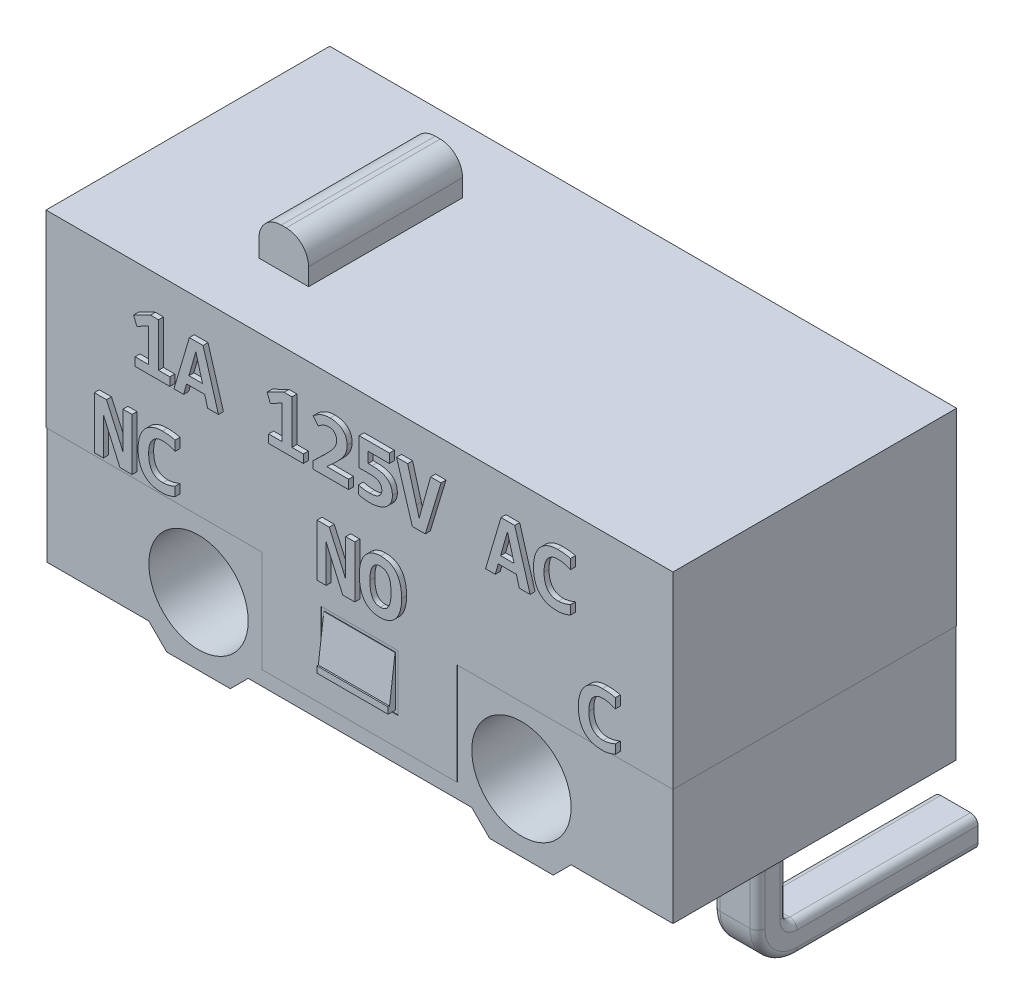
from build123d import *

# Parameters (mm, degrees)
IZIM1_R                     = 1
Y_KSEKLIK_EKSTR_ZYON1_DEPTH = 5.7
IZIM2_W                     = 1.555423368
IZIM2_H                     = 1.128679348
Y_KSEKLIK_EKSTR_ZYON2_DEPTH = 0.01
IZIM3_W                     = 5.71
IZIM3_H                     = 3.791444843
Y_KSEKLIK_EKSTR_ZYON3_DEPTH = 0.01
IZIM4_W                     = 1.433547672
IZIM4_H                     = 1.00666385
Y_KSEKLIK_EKSTR_ZYON4_DEPTH = 0.15
KES_EKSTR_ZYON1_DEPTH       = 2.15
IZIM7_W                     = 1
IZIM7_H                     = 3.1
Y_KSEKLIK_EKSTR_ZYON5_DEPTH = 0.8
RADYUS1_R                   = 0.45
IZIM8_W                     = 0.9
IZIM8_H                     = 0.6
IZIM12_W                    = 0.9
IZIM12_H                    = 0.6
RADYUS2_R                   = 0.15
Y_KSEKLIK_EKSTR_ZYON6_DEPTH = 0.1


with BuildPart() as part:
    # Çizim1 → Yükseklik-Ekstrüzyon1 (new body)
    with BuildSketch(Plane.XY):
        Polygon((-2.25, -2.89003396), (2.25, -2.89003396), (2.60996604, -3.25), (3.89003396, -3.25), (4.25, -2.89003396), (6.3, -2.89003396), (6.3, 3.25), (-6.3, 3.25), (-6.3, -2.89003396), (-4.25, -2.89003396), (-3.89003396, -3.25), (-2.60996604, -3.25), align=None)
        with Locations((-3.25, -1.89003396)):
            Circle(IZIM1_R, mode=Mode.SUBTRACT)
        with Locations((3.25, -1.89003396)):
            Circle(IZIM1_R, mode=Mode.SUBTRACT)
    extrude(amount=Y_KSEKLIK_EKSTR_ZYON1_DEPTH)

    # Çizim2 → Yükseklik-Ekstrüzyon2 (add)
    with BuildSketch(Plane.XY.offset(5.7)):
        Polygon((-6.3, -0.541444843), (-1.959045888, -0.541444843), (-1.959045888, -2.589090797), (1.959045888, -2.589090797), (1.959045888, -0.541444843), (6.3, -0.541444843), (6.3, 3.25), (-6.3, 3.25), align=None)
        with Locations((0, -1.453772924)):
            Rectangle(IZIM2_W, IZIM2_H, mode=Mode.SUBTRACT)
    extrude(amount=Y_KSEKLIK_EKSTR_ZYON2_DEPTH)

    # Çizim3 → Yükseklik-Ekstrüzyon3 (add)
    with BuildSketch(Plane(origin=(6.3, 0, 0), x_dir=(0, 0, -1), z_dir=(1, 0, 0))):
        with Locations((-2.855, 1.354277579)):
            Rectangle(IZIM3_W, IZIM3_H)
    y_kseklik_ekstr_zyon3 = extrude(amount=Y_KSEKLIK_EKSTR_ZYON3_DEPTH)

    # Aynalama1: Yükseklik-Ekstrüzyon3 across plane
    add(y_kseklik_ekstr_zyon3.mirror(Plane(origin=(0, 0, 0), x_dir=(0, 0, 1), z_dir=(1, 0, 0))))

    # Çizim4 → Yükseklik-Ekstrüzyon4 (add)
    with BuildSketch(Plane.XY.offset(5.7)):
        with Locations((0, -1.453772924)):
            Rectangle(IZIM4_W, IZIM4_H)
    extrude(amount=Y_KSEKLIK_EKSTR_ZYON4_DEPTH)

    # Çizim5 → Kes-Ekstrüzyon1 (cut)
    with BuildSketch(Plane(origin=(0.716773836, 0, 0), x_dir=(0, 0, -1), z_dir=(1, 0, 0))):
        Polygon((-5.85, -1.828901047), (-5.821636006, -1.828901047), (-5.71, -0.950440999), (-5.85, -0.950440999), align=None)
    extrude(amount=-KES_EKSTR_ZYON1_DEPTH, mode=Mode.SUBTRACT)

    # Çizim7 → Yükseklik-Ekstrüzyon5 (add)
    with BuildSketch(Plane(origin=(0, 3.25, 0), x_dir=(1, 0, 0), z_dir=(0, 1, 0))):
        with Locations((-2.829853544, -2.855)):
            Rectangle(IZIM7_W, IZIM7_H)
    extrude(amount=Y_KSEKLIK_EKSTR_ZYON5_DEPTH)

    # Radyus1
    radyus1_edges = [part.edges().sort_by_distance(p)[0] for p in [
        (-2.329853544, 4.05, 2.855),
        (-3.329853544, 4.05, 2.855),
    ]]
    fillet(radyus1_edges, radius=RADYUS1_R)

    # Süpür1: sweep along a path in Çizim10
    with BuildLine(Plane(origin=(-5, 0, 0), x_dir=(0, 0, -1), z_dir=(1, 0, 0))) as s_p_r1_path:
        Line((-2.85, -2.89003396), (-2.85, -4.75))
        ThreePointArc((-2.85, -4.75), (-2.703553391, -5.103553391), (-2.35, -5.25))
        Line((-2.35, -5.25), (1.29, -5.25))
    # Çizim8 → Süpür1 (sweep)
    with BuildSketch(Plane(origin=(0, -2.89003396, 0), x_dir=(-1, 0, 0), z_dir=(0, -1, 0))):
        with Locations((5, -2.85)):
            Rectangle(IZIM8_W, IZIM8_H)
    s_p_r1 = sweep(path=s_p_r1_path.line)

    # Süpür2: sweep along a path in Çizim13
    with BuildLine(Plane(origin=(0, 0, 0), x_dir=(0, 0, -1), z_dir=(1, 0, 0))) as s_p_r2_path:
        Line((-2.85, -2.89003396), (-2.85, -4.75))
        ThreePointArc((-2.85, -4.75), (-2.703553391, -5.103553391), (-2.35, -5.25))
        Line((-2.35, -5.25), (1.29, -5.25))
    # Çizim12 → Süpür2 (sweep)
    with BuildSketch(Plane.XZ.offset(2.89003396)):
        with Locations((0, 2.85)):
            Rectangle(IZIM12_W, IZIM12_H)
    sweep(path=s_p_r2_path.line)

    # Aynalama2: Süpür1 across plane
    add(s_p_r1.mirror(Plane(origin=(0, 0, 0), x_dir=(0, 0, 1), z_dir=(1, 0, 0))))

    # Radyus2
    radyus2_edges = [part.edges().sort_by_distance(p)[0] for p in [
        (-5.45, -5.55, 0.53),
        (-4.55, -4.95, 0.53),
        (-5.45, -5.315685425, 2.915685425),
        (-4.55, -4.891421356, 2.491421356),
        (-4.55, -5.315685425, 2.915685425),
        (-4.55, -5.55, 0.53),
        (-4.55, -3.82001698, 2.55),
        (-4.55, -3.82001698, 3.15),
        (-5.45, -4.891421356, 2.491421356),
        (-5.45, -4.95, 0.53),
        (-5.45, -3.82001698, 3.15),
        (-5.45, -3.82001698, 2.55),
        (-0.45, -5.55, 0.53),
        (0.45, -4.95, 0.53),
        (-0.45, -5.315685425, 2.915685425),
        (0.45, -4.891421356, 2.491421356),
        (0.45, -5.315685425, 2.915685425),
        (0.45, -5.55, 0.53),
        (0.45, -3.82001698, 2.55),
        (0.45, -3.82001698, 3.15),
        (-0.45, -4.891421356, 2.491421356),
        (-0.45, -4.95, 0.53),
        (-0.45, -3.82001698, 3.15),
        (-0.45, -3.82001698, 2.55),
        (5.45, -4.95, 0.53),
        (4.55, -5.55, 0.53),
        (5.45, -4.891421356, 2.491421356),
        (4.55, -5.315685425, 2.915685425),
        (4.55, -4.891421356, 2.491421356),
        (4.55, -4.95, 0.53),
        (4.55, -3.82001698, 3.15),
        (4.55, -3.82001698, 2.55),
        (5.45, -5.315685425, 2.915685425),
        (5.45, -5.55, 0.53),
        (5.45, -3.82001698, 2.55),
        (5.45, -3.82001698, 3.15),
    ]]
    fillet(radyus2_edges, radius=RADYUS2_R)

    # Çizim14 → Yükseklik-Ekstrüzyon6 (add)
    # profile 1 of 13: a face of its own
    with BuildSketch(Plane.XY.offset(5.71)):
        Polygon((-4.416969828, 1.520931058), (-4.416969828, 1.68800321), (-4.143579033, 1.68800321), (-4.143579033, 2.362699416), (-4.381609386, 2.2347848), (-4.447346583, 2.401856952), (-4.107506636, 2.568929105), (-3.946130126, 2.568929105), (-3.946130126, 1.68800321), (-3.718304463, 1.68800321), (-3.718304463, 1.520931058), align=None)
    # profile 2 of 13: a face of its own
    with BuildSketch(Plane.XY.offset(5.71)):
        Polygon((-2.956512405, 1.520931058), (-3.014892731, 1.733568343), (-3.379651109, 1.733568343), (-3.439455345, 1.520931058), (-3.634768387, 1.520931058), (-3.323881285, 2.568929105), (-3.048354625, 2.568929105), (-2.738654115, 1.520931058), align=None)
        Polygon((-3.19430544, 2.389279077), (-3.332187429, 1.900640495), (-3.060457863, 1.900640495), align=None, mode=Mode.SUBTRACT)
    # profile 3 of 13: a face of its own
    with BuildSketch(Plane.XY.offset(5.71)):
        Polygon((-1.728627012, 1.520931058), (-1.728627012, 1.68800321), (-1.455236217, 1.68800321), (-1.455236217, 2.362699416), (-1.693266571, 2.2347848), (-1.759003767, 2.401856952), (-1.419163821, 2.568929105), (-1.25778731, 2.568929105), (-1.25778731, 1.68800321), (-1.029961647, 1.68800321), (-1.029961647, 1.520931058), align=None)
    # profile 4 of 13: a face of its own
    with BuildSketch(Plane.XY.offset(5.71)):
        with BuildLine():
            Line((-0.83251274, 1.520931058), (-0.83251274, 1.667356509))
            Line((-0.83251274, 1.667356509), (-0.580005964, 1.912031778))
            add(Edge.make_bspline(
                [(-0.580005964, 1.912031778), (-0.568618879, 1.923111493), (-0.546845415, 1.944297229), (-0.516860272, 1.975782675), (-0.489912698, 2.004389433), (-0.466378649, 2.030894134), (-0.446103378, 2.055791112), (-0.428262301, 2.079033858), (-0.412737093, 2.100778787), (-0.399792831, 2.121408063), (-0.388938534, 2.140910578), (-0.380440981, 2.159694798), (-0.373631265, 2.177573782), (-0.367280961, 2.200602736), (-0.362873944, 2.229710002), (-0.362075499, 2.253122839), (-0.361673038, 2.264924236)],
                knots=[0, 0, 0, 0, 1.561346149, 2.985479849, 4.272660798, 5.42387168, 6.4681479, 7.427594435, 8.303382019, 9.092890023, 9.820107477, 10.495077279, 11.117492523, 11.698467986, 12.839897307, 14, 14, 14, 14], degree=3))
            add(Edge.make_bspline(
                [(-0.361673038, 2.264924236), (-0.362093806, 2.275020659), (-0.362927136, 2.295016548), (-0.370603558, 2.3237196), (-0.382161257, 2.350186268), (-0.399238486, 2.372833561), (-0.420550739, 2.391924473), (-0.442151649, 2.403658199), (-0.461428388, 2.410480927), (-0.477180173, 2.414231505), (-0.4939374, 2.416739507), (-0.505478318, 2.416941381), (-0.511420947, 2.41704533)],
                knots=[0, 0, 0, 0, 1.259052347, 2.493543675, 3.687736162, 4.846054809, 6.008246034, 7.237941048, 7.888132915, 8.5593184, 9.258166694, 10, 10, 10, 10], degree=3))
            add(Edge.make_bspline(
                [(-0.511420947, 2.41704533), (-0.521640591, 2.416692468), (-0.541783819, 2.415996967), (-0.571437087, 2.41148749), (-0.599917448, 2.403567533), (-0.627191172, 2.39246543), (-0.653709491, 2.379134271), (-0.679239373, 2.363317978), (-0.70436182, 2.345832994), (-0.720120807, 2.332606046), (-0.728092645, 2.325915065)],
                knots=[0, 0, 0, 0, 1.020414048, 2.011267059, 2.986668027, 3.96497488, 4.94697347, 5.946696085, 6.961316025, 8, 8, 8, 8], degree=3))
            Line((-0.728092645, 2.325915065), (-0.83251274, 2.451931134))
            add(Edge.make_bspline(
                [(-0.83251274, 2.451931134), (-0.820875157, 2.461616652), (-0.7975957, 2.48099126), (-0.759881216, 2.506655407), (-0.719969933, 2.529145857), (-0.678086879, 2.548715926), (-0.634243611, 2.56490538), (-0.588169444, 2.575769765), (-0.540449883, 2.583084397), (-0.507968484, 2.583769722), (-0.491486202, 2.584117482)],
                knots=[0, 0, 0, 0, 0.971414743, 1.943187718, 2.923163908, 3.90905488, 4.908116413, 5.916732171, 6.942871654, 8, 8, 8, 8], degree=3))
            add(Edge.make_bspline(
                [(-0.491486202, 2.584117482), (-0.478897759, 2.58392083), (-0.454214574, 2.583535238), (-0.418130972, 2.579598786), (-0.38384468, 2.573516084), (-0.351446149, 2.564975401), (-0.320995101, 2.554102373), (-0.292644628, 2.540845568), (-0.266607186, 2.52512357), (-0.24294189, 2.506998646), (-0.221703638, 2.486441412), (-0.202745595, 2.463543911), (-0.186673814, 2.438016831), (-0.173083081, 2.410258174), (-0.162014803, 2.380346156), (-0.154680405, 2.348025438), (-0.149642315, 2.313653789), (-0.149241833, 2.289941399), (-0.149035753, 2.27773943)],
                knots=[0, 0, 0, 0, 1.159472778, 2.273472863, 3.340013536, 4.365414322, 5.356781803, 6.31537468, 7.244130825, 8.153815157, 9.055875647, 9.962049253, 10.886103095, 11.828148954, 12.805810483, 13.817047342, 14.876691883, 16, 16, 16, 16], degree=3))
            add(Edge.make_bspline(
                [(-0.149035753, 2.27773943), (-0.1491657, 2.267523156), (-0.149422291, 2.247350282), (-0.153036544, 2.217643138), (-0.157984397, 2.188839393), (-0.16582431, 2.161154248), (-0.175347668, 2.134206912), (-0.186772606, 2.107683963), (-0.200432529, 2.08166644), (-0.215618895, 2.055705984), (-0.232714422, 2.029954467), (-0.252192091, 2.004671181), (-0.272963035, 1.978863311), (-0.296101953, 1.953355838), (-0.321019617, 1.927548317), (-0.346953047, 1.900474722), (-0.375304842, 1.873444737), (-0.39473035, 1.855144126), (-0.404627668, 1.845819945)],
                knots=[0, 0, 0, 0, 0.945736526, 1.867434716, 2.768631143, 3.650402628, 4.528787893, 5.414963327, 6.32280855, 7.249039709, 8.200182995, 9.183579422, 10.204429958, 11.268168642, 12.372135405, 13.527717836, 14.740369513, 16, 16, 16, 16], degree=3))
            Line((-0.404627668, 1.845819945), (-0.559121945, 1.703191588))
            Line((-0.559121945, 1.703191588), (-0.118658998, 1.703191588))
            Line((-0.118658998, 1.703191588), (-0.118658998, 1.520931058))
            Line((-0.118658998, 1.520931058), (-0.83251274, 1.520931058))
        make_face()
    # profile 5 of 13: a face of its own
    with BuildSketch(Plane.XY.offset(5.71)):
        with BuildLine():
            add(Edge.make_bspline(
                [(0.762266897, 1.857923183), (0.761895026, 1.844209736), (0.761168127, 1.817403983), (0.754356799, 1.778402068), (0.743185557, 1.74180657), (0.727628668, 1.7076253), (0.708128304, 1.676062855), (0.68498206, 1.647037651), (0.65869401, 1.620378144), (0.62874809, 1.59665582), (0.59595164, 1.575442276), (0.560089633, 1.557335661), (0.521736843, 1.541181585), (0.480515774, 1.52840752), (0.437079713, 1.518095939), (0.391583807, 1.511236892), (0.344372287, 1.506442165), (0.31224467, 1.505978197), (0.295936244, 1.50574268)],
                knots=[0, 0, 0, 0, 1.003806332, 1.962145891, 2.889593837, 3.79979359, 4.705166527, 5.600170263, 6.513886126, 7.441460774, 8.392979074, 9.369986185, 10.380460185, 11.437875437, 12.52715139, 13.647472168, 14.805824136, 16, 16, 16, 16], degree=3))
            add(Edge.make_bspline(
                [(0.295936244, 1.50574268), (0.287391207, 1.505928885), (0.269655019, 1.506315374), (0.242490559, 1.507920949), (0.214343903, 1.510907864), (0.185850997, 1.514398448), (0.157415561, 1.518603001), (0.129787725, 1.523744045), (0.103616714, 1.529651786), (0.086848125, 1.534020184), (0.07878991, 1.536119435)],
                knots=[0, 0, 0, 0, 0.933203419, 1.936969169, 2.970037408, 4.023167792, 5.071256358, 6.108037116, 7.090809354, 8, 8, 8, 8], degree=3))
            Line((0.07878991, 1.536119435), (0.07878991, 1.703191588))
            add(Edge.make_bspline(
                [(0.07878991, 1.703191588), (0.086676926, 1.700885185), (0.102818325, 1.696164951), (0.12823615, 1.690642574), (0.15519634, 1.685360592), (0.19365415, 1.679379484), (0.243507414, 1.67406946), (0.283896658, 1.673235123), (0.304242388, 1.672814833)],
                knots=[0, 0, 0, 0, 0.647950827, 1.326082186, 2.050513233, 2.814747821, 4.395456963, 6, 6, 6, 6], degree=3))
            add(Edge.make_bspline(
                [(0.304242388, 1.672814833), (0.313897751, 1.672942485), (0.33267955, 1.673190797), (0.36001503, 1.675369849), (0.385637938, 1.678817776), (0.409392014, 1.683868398), (0.431477997, 1.68988102), (0.451572469, 1.697801637), (0.470145745, 1.706758321), (0.486716002, 1.717465722), (0.501452685, 1.729373601), (0.514496885, 1.742159344), (0.52521, 1.756437821), (0.534301196, 1.771552185), (0.541321742, 1.787908071), (0.545853524, 1.805372603), (0.54921472, 1.823780065), (0.549489027, 1.836468948), (0.549629612, 1.842972124)],
                knots=[0, 0, 0, 0, 1.376103243, 2.676822839, 3.906334316, 5.058542542, 6.13657794, 7.164747953, 8.132985769, 9.071346473, 9.969481245, 10.830611169, 11.667327079, 12.506622408, 13.340217227, 14.193708991, 15.074258204, 16, 16, 16, 16], degree=3))
            add(Edge.make_bspline(
                [(0.549629612, 1.842972124), (0.549430958, 1.849702361), (0.549046097, 1.862741124), (0.546539601, 1.881740139), (0.54168733, 1.899280112), (0.535381417, 1.915642131), (0.526866811, 1.930432316), (0.516944871, 1.944226538), (0.504676504, 1.956257961), (0.490683085, 1.967122658), (0.474688518, 1.976661741), (0.456350532, 1.984635695), (0.436008621, 1.991788587), (0.413209366, 1.997475412), (0.388189309, 2.001553566), (0.360944875, 2.004646464), (0.331481158, 2.006534522), (0.311048361, 2.006814072), (0.300445294, 2.006959137)],
                knots=[0, 0, 0, 0, 0.950031935, 1.840535706, 2.696350568, 3.513191612, 4.308068879, 5.09854323, 5.903780938, 6.723364091, 7.594552156, 8.524092423, 9.540980844, 10.63493007, 11.835307573, 13.116308258, 14.503583317, 16, 16, 16, 16], degree=3))
            Line((0.300445294, 2.006959137), (0.093978287, 2.006959137))
            Line((0.093978287, 2.006959137), (0.093978287, 2.568929105))
            Line((0.093978287, 2.568929105), (0.701513387, 2.568929105))
            Line((0.701513387, 2.568929105), (0.701513387, 2.386668575))
            Line((0.701513387, 2.386668575), (0.276238817, 2.386668575))
            Line((0.276238817, 2.386668575), (0.276238817, 2.17403129))
            Line((0.276238817, 2.17403129), (0.352655341, 2.17403129))
            add(Edge.make_bspline(
                [(0.352655341, 2.17403129), (0.366027875, 2.173828331), (0.392560681, 2.173425635), (0.431854796, 2.170840532), (0.470264713, 2.166288282), (0.507547814, 2.160030337), (0.543462107, 2.151582305), (0.577433995, 2.140644183), (0.609019056, 2.126356897), (0.638539483, 2.109909614), (0.66567584, 2.0903872), (0.689763138, 2.067390883), (0.710987265, 2.041290628), (0.729532214, 2.01215692), (0.744379722, 1.979219422), (0.755043647, 1.942341034), (0.761090753, 1.901393549), (0.761863966, 1.872815518), (0.762266897, 1.857923183)],
                knots=[0, 0, 0, 0, 1.087776032, 2.158285899, 3.201468592, 4.232895783, 5.231774263, 6.200368663, 7.130739854, 8.04700741, 8.945408995, 9.842057509, 10.747551757, 11.675873473, 12.643505556, 13.67589576, 14.788883008, 16, 16, 16, 16], degree=3))
        make_face()
    # profile 6 of 13: a face of its own
    with BuildSketch(Plane.XY.offset(5.71)):
        Polygon((1.424859865, 1.520931058), (1.163809627, 1.520931058), (0.845802973, 2.568929105), (1.069356904, 2.568929105), (1.244972519, 1.937899483), (1.301454298, 1.73095784), (1.359597305, 1.949765403), (1.532127781, 2.568929105), (1.741917245, 2.568929105), align=None)
    # profile 7 of 13: a face of its own
    with BuildSketch(Plane.XY.offset(5.71)):
        Polygon((3.316287499, 1.520931058), (3.257907173, 1.733568343), (2.893148795, 1.733568343), (2.833344559, 1.520931058), (2.638031517, 1.520931058), (2.948918619, 2.568929105), (3.224445279, 2.568929105), (3.534145789, 1.520931058), align=None)
        Polygon((3.078494464, 2.389279077), (2.940612475, 1.900640495), (3.212342041, 1.900640495), align=None, mode=Mode.SUBTRACT)
    # profile 8 of 13: a face of its own
    with BuildSketch(Plane.XY.offset(5.71)):
        with BuildLine():
            add(Edge.make_bspline(
                [(4.346723984, 1.56649619), (4.335142586, 1.561552242), (4.312420239, 1.551852366), (4.278075455, 1.539554), (4.244357513, 1.529045417), (4.210944487, 1.520448665), (4.177469104, 1.513601636), (4.143505009, 1.509319837), (4.108907983, 1.506244695), (4.08560172, 1.505911361), (4.073807826, 1.50574268)],
                knots=[0, 0, 0, 0, 1.072602722, 2.104413604, 3.106297595, 4.08050826, 5.042709706, 6.014913564, 6.995467464, 8, 8, 8, 8], degree=3))
            add(Edge.make_bspline(
                [(4.073807826, 1.50574268), (4.055358331, 1.506146483), (4.019537694, 1.506930486), (3.967344393, 1.513185612), (3.918469916, 1.523519437), (3.872741153, 1.537945776), (3.830496971, 1.556795435), (3.791536637, 1.579679831), (3.755933604, 1.606604083), (3.723934724, 1.637714266), (3.695483845, 1.672793926), (3.671045375, 1.712159077), (3.649856164, 1.755198445), (3.632543447, 1.802298157), (3.619071829, 1.853319697), (3.60952636, 1.908262108), (3.603423934, 1.967110372), (3.602809971, 2.007655219), (3.602493487, 2.028555112)],
                knots=[0, 0, 0, 0, 1.102605573, 2.140764961, 3.136846793, 4.08496906, 5.001529512, 5.896051515, 6.780328523, 7.66316301, 8.557497515, 9.473264751, 10.427030373, 11.420482266, 12.467702166, 13.577100782, 14.751053738, 16, 16, 16, 16], degree=3))
            add(Edge.make_bspline(
                [(3.602493487, 2.028555112), (3.602873191, 2.050011314), (3.603613371, 2.091837296), (3.610231424, 2.152663861), (3.620369363, 2.209990175), (3.635477149, 2.263435534), (3.654060743, 2.31326291), (3.676750613, 2.358948459), (3.702592575, 2.400911376), (3.732459639, 2.438580331), (3.765765201, 2.472236598), (3.802641969, 2.501570897), (3.842640138, 2.526943108), (3.886211929, 2.547599688), (3.932760871, 2.563903187), (3.982173671, 2.575883178), (4.034456254, 2.582748691), (4.070228034, 2.583654338), (4.088521567, 2.584117482)],
                knots=[0, 0, 0, 0, 1.232307787, 2.402218284, 3.511138658, 4.573037126, 5.588482404, 6.562047137, 7.499038646, 8.414657469, 9.317692522, 10.213424542, 11.116219401, 12.033010505, 12.977368732, 13.94518829, 14.949178196, 16, 16, 16, 16], degree=3))
            add(Edge.make_bspline(
                [(4.088521567, 2.584117482), (4.10023139, 2.584128101), (4.122945812, 2.584148699), (4.156162629, 2.582696162), (4.188022243, 2.581404664), (4.21916738, 2.577990832), (4.25025796, 2.574236609), (4.281661952, 2.568367491), (4.314026171, 2.562351798), (4.335680474, 2.55664907), (4.346723984, 2.553740727)],
                knots=[0, 0, 0, 0, 1.077376558, 2.089868288, 3.059369192, 4.010411707, 4.972009834, 5.940198088, 6.949518525, 8, 8, 8, 8], degree=3))
            Line((4.346723984, 2.553740727), (4.346723984, 2.35629182))
            add(Edge.make_bspline(
                [(4.346723984, 2.35629182), (4.335389472, 2.361489443), (4.313194809, 2.371667164), (4.279599477, 2.384351971), (4.246989037, 2.395256413), (4.215095839, 2.403133966), (4.184542969, 2.409409998), (4.155216728, 2.413644637), (4.127335731, 2.41639783), (4.109174062, 2.41683421), (4.100387487, 2.41704533)],
                knots=[0, 0, 0, 0, 1.170030163, 2.291093263, 3.368831198, 4.395296508, 5.372370687, 6.295361994, 7.175300008, 8, 8, 8, 8], degree=3))
            add(Edge.make_bspline(
                [(4.100387487, 2.41704533), (4.088187591, 2.416747353), (4.06462782, 2.416171918), (4.030602563, 2.41116653), (3.999332272, 2.402698867), (3.970854826, 2.390704291), (3.944934323, 2.37579577), (3.921274797, 2.358265014), (3.900299409, 2.337603196), (3.881730884, 2.314462051), (3.865496058, 2.288793705), (3.851563887, 2.260786336), (3.839863604, 2.230440001), (3.830782828, 2.197895365), (3.823658728, 2.163477185), (3.818821453, 2.127308698), (3.815577619, 2.089526188), (3.815281696, 2.063764449), (3.815130772, 2.050625723)],
                knots=[0, 0, 0, 0, 1.109729706, 2.143049175, 3.121026665, 4.050204485, 4.946654748, 5.836403406, 6.722153568, 7.618170183, 8.530804457, 9.480502004, 10.460411604, 11.48580219, 12.551706219, 13.656287425, 14.804684813, 16, 16, 16, 16], degree=3))
            add(Edge.make_bspline(
                [(3.815130772, 2.050625723), (3.815249714, 2.036772736), (3.815481852, 2.009735996), (3.819117398, 1.970399304), (3.823780314, 1.93315479), (3.831186235, 1.898346328), (3.84051943, 1.865868474), (3.852519824, 1.83605785), (3.86641132, 1.80856775), (3.882902827, 1.783727805), (3.901680566, 1.761385528), (3.923204987, 1.742150636), (3.947016829, 1.725554258), (3.973253586, 1.711681361), (4.002163708, 1.701036219), (4.033557144, 1.69357003), (4.067401298, 1.688612371), (4.090876026, 1.688210651), (4.102997989, 1.68800321)],
                knots=[0, 0, 0, 0, 1.256876421, 2.453033611, 3.583260076, 4.661975506, 5.679853963, 6.646528144, 7.574590913, 8.470745685, 9.346915849, 10.216322401, 11.082788599, 11.975686973, 12.902638023, 13.870910894, 14.900573425, 16, 16, 16, 16], degree=3))
            add(Edge.make_bspline(
                [(4.102997989, 1.68800321), (4.112344584, 1.688231104), (4.131821076, 1.688705991), (4.161840628, 1.692837174), (4.19307808, 1.69873069), (4.225016674, 1.706068064), (4.256844357, 1.715047111), (4.288156702, 1.725460566), (4.318148738, 1.73665655), (4.33741587, 1.744815205), (4.346723984, 1.74875672)],
                knots=[0, 0, 0, 0, 0.887372101, 1.849111607, 2.873273884, 3.906654629, 4.960374994, 6.012916101, 7.040022999, 8, 8, 8, 8], degree=3))
            Line((4.346723984, 1.74875672), (4.346723984, 1.56649619))
        make_face()
    # profile 9 of 13: a face of its own
    with BuildSketch(Plane.XY.offset(5.71)):
        with BuildLine():
            add(Edge.make_bspline(
                [(5.249263072, -0.40873895), (5.237681674, -0.413682898), (5.214959326, -0.423382774), (5.180614542, -0.43568114), (5.1468966, -0.446189723), (5.113483574, -0.454786475), (5.080008191, -0.461633504), (5.046044097, -0.465915303), (5.01144707, -0.468990444), (4.988140808, -0.469323779), (4.976346914, -0.46949246)],
                knots=[0, 0, 0, 0, 1.072602722, 2.104413604, 3.106297595, 4.08050826, 5.042709706, 6.014913564, 6.995467464, 8, 8, 8, 8], degree=3))
            add(Edge.make_bspline(
                [(4.976346914, -0.46949246), (4.957897418, -0.469088657), (4.922076781, -0.468304654), (4.86988348, -0.462049528), (4.821009003, -0.451715703), (4.775280241, -0.437289364), (4.733036058, -0.418439705), (4.694075724, -0.395555309), (4.658472691, -0.368631057), (4.626473811, -0.337520874), (4.598022933, -0.302441214), (4.573584462, -0.263076063), (4.552395251, -0.220036695), (4.535082535, -0.172936982), (4.521610916, -0.121915443), (4.512065447, -0.066973031), (4.505963021, -0.008124767), (4.505349058, 0.032420079), (4.505032575, 0.053319972)],
                knots=[0, 0, 0, 0, 1.102605573, 2.140764961, 3.136846793, 4.08496906, 5.001529512, 5.896051515, 6.780328523, 7.66316301, 8.557497515, 9.473264751, 10.427030373, 11.420482266, 12.467702166, 13.577100782, 14.751053738, 16, 16, 16, 16], degree=3))
            add(Edge.make_bspline(
                [(4.505032575, 0.053319972), (4.505412278, 0.074776174), (4.506152458, 0.116602156), (4.512770511, 0.177428722), (4.522908451, 0.234755036), (4.538016236, 0.288200394), (4.55659983, 0.33802777), (4.5792897, 0.383713319), (4.605131662, 0.425676236), (4.634998726, 0.463345191), (4.668304288, 0.497001459), (4.705181056, 0.526335757), (4.745179225, 0.551707968), (4.788751016, 0.572364548), (4.835299958, 0.588668047), (4.884712759, 0.600648038), (4.936995341, 0.607513551), (4.972767121, 0.608419198), (4.991060654, 0.608882342)],
                knots=[0, 0, 0, 0, 1.232307787, 2.402218284, 3.511138658, 4.573037126, 5.588482404, 6.562047137, 7.499038646, 8.414657469, 9.317692522, 10.213424542, 11.116219401, 12.033010505, 12.977368732, 13.94518829, 14.949178196, 16, 16, 16, 16], degree=3))
            add(Edge.make_bspline(
                [(4.991060654, 0.608882342), (5.002770477, 0.608892961), (5.025484899, 0.60891356), (5.058701716, 0.607461022), (5.090561331, 0.606169525), (5.121706467, 0.602755692), (5.152797047, 0.599001469), (5.184201039, 0.593132351), (5.216565258, 0.587116659), (5.238219561, 0.58141393), (5.249263072, 0.578505587)],
                knots=[0, 0, 0, 0, 1.077376558, 2.089868288, 3.059369192, 4.010411707, 4.972009834, 5.940198088, 6.949518525, 8, 8, 8, 8], degree=3))
            Line((5.249263072, 0.578505587), (5.249263072, 0.38105668))
            add(Edge.make_bspline(
                [(5.249263072, 0.38105668), (5.237928559, 0.386254303), (5.215733896, 0.396432024), (5.182138564, 0.409116831), (5.149528124, 0.420021273), (5.117634926, 0.427898826), (5.087082056, 0.434174858), (5.057755815, 0.438409497), (5.029874819, 0.44116269), (5.011713149, 0.44159907), (5.002926574, 0.44181019)],
                knots=[0, 0, 0, 0, 1.170030163, 2.291093263, 3.368831198, 4.395296508, 5.372370687, 6.295361994, 7.175300008, 8, 8, 8, 8], degree=3))
            add(Edge.make_bspline(
                [(5.002926574, 0.44181019), (4.990726678, 0.441512213), (4.967166907, 0.440936778), (4.93314165, 0.43593139), (4.90187136, 0.427463727), (4.873393914, 0.415469151), (4.84747341, 0.40056063), (4.823813884, 0.383029874), (4.802838497, 0.362368056), (4.784269971, 0.339226911), (4.768035145, 0.313558565), (4.754102975, 0.285551196), (4.742402691, 0.255204861), (4.733321915, 0.222660225), (4.726197816, 0.188242045), (4.721360541, 0.152073558), (4.718116706, 0.114291048), (4.717820783, 0.088529309), (4.717669859, 0.075390583)],
                knots=[0, 0, 0, 0, 1.109729706, 2.143049175, 3.121026665, 4.050204485, 4.946654748, 5.836403406, 6.722153568, 7.618170183, 8.530804457, 9.480502004, 10.460411604, 11.48580219, 12.551706219, 13.656287425, 14.804684813, 16, 16, 16, 16], degree=3))
            add(Edge.make_bspline(
                [(4.717669859, 0.075390583), (4.717788801, 0.061537596), (4.718020939, 0.034500856), (4.721656486, -0.004835836), (4.726319401, -0.04208035), (4.733725322, -0.076888812), (4.743058518, -0.109366666), (4.755058912, -0.13917729), (4.768950407, -0.16666739), (4.785441914, -0.191507335), (4.804219653, -0.213849612), (4.825744074, -0.233084504), (4.849555916, -0.249680882), (4.875792673, -0.263553779), (4.904702795, -0.274198921), (4.936096231, -0.28166511), (4.969940386, -0.286622769), (4.993415113, -0.287024489), (5.005537077, -0.28723193)],
                knots=[0, 0, 0, 0, 1.256876421, 2.453033611, 3.583260076, 4.661975506, 5.679853963, 6.646528144, 7.574590913, 8.470745685, 9.346915849, 10.216322401, 11.082788599, 11.975686973, 12.902638023, 13.870910894, 14.900573425, 16, 16, 16, 16], degree=3))
            add(Edge.make_bspline(
                [(5.005537077, -0.28723193), (5.014883671, -0.287004036), (5.034360163, -0.286529148), (5.064379715, -0.282397966), (5.095617167, -0.27650445), (5.127555761, -0.269167076), (5.159383444, -0.260188029), (5.190695789, -0.249774574), (5.220687825, -0.23857859), (5.239954957, -0.230419935), (5.249263072, -0.22647842)],
                knots=[0, 0, 0, 0, 0.887372101, 1.849111607, 2.873273884, 3.906654629, 4.960374994, 6.012916101, 7.040022999, 8, 8, 8, 8], degree=3))
            Line((5.249263072, -0.22647842), (5.249263072, -0.40873895))
        make_face()
    # profile 10 of 13: a face of its own
    with BuildSketch(Plane.XY.offset(5.71)):
        Polygon((-0.237252037, -0.375294677), (-0.514439926, 0.250039303), (-0.571396341, 0.384836153), (-0.571396341, -0.049693834), (-0.571396341, -0.375294677), (-0.753656871, -0.375294677), (-0.753656871, 0.67270337), (-0.508744284, 0.67270337), (-0.22633539, 0.043334978), (-0.176498527, -0.079358634), (-0.176498527, 0.383174924), (-0.176498527, 0.67270337), (0.005762003, 0.67270337), (0.005762003, -0.375294677), align=None)
    # profile 11 of 13: a face of its own
    with BuildSketch(Plane.XY.offset(5.71)):
        with BuildLine():
            add(Edge.make_bspline(
                [(0.947441408, 0.153450715), (0.947033002, 0.130575811), (0.946244272, 0.086398928), (0.940170028, 0.022496378), (0.929571307, -0.036482808), (0.914864261, -0.090620372), (0.896588107, -0.139913367), (0.875185168, -0.184725875), (0.850563442, -0.224987675), (0.822659683, -0.260656052), (0.791752939, -0.291583286), (0.758746372, -0.318762584), (0.722730032, -0.341147212), (0.684516409, -0.359416454), (0.644375441, -0.373437935), (0.602643101, -0.382986752), (0.559713106, -0.389561322), (0.530497985, -0.390173976), (0.515759241, -0.390483054)],
                knots=[0, 0, 0, 0, 1.399094986, 2.701985343, 3.921606295, 5.060250114, 6.128937938, 7.133140352, 8.093336986, 9.010033534, 9.896223585, 10.76303321, 11.619598843, 12.483160966, 13.349322064, 14.214333538, 15.099148625, 16, 16, 16, 16], degree=3))
            add(Edge.make_bspline(
                [(0.515759241, -0.390483054), (0.498887686, -0.390101117), (0.466123263, -0.389359399), (0.418577508, -0.382815157), (0.374224507, -0.372268487), (0.333075735, -0.357303243), (0.295222129, -0.337913349), (0.260538052, -0.314321793), (0.229209172, -0.286221969), (0.201110182, -0.254005883), (0.176328308, -0.217647906), (0.155014657, -0.177315446), (0.136906077, -0.133120639), (0.122446606, -0.085060366), (0.110628071, -0.033319897), (0.102924183, 0.022345304), (0.097737446, 0.081840441), (0.097179812, 0.122824564), (0.096892268, 0.143957979)],
                knots=[0, 0, 0, 0, 1.046182631, 2.031678192, 2.97076483, 3.86965419, 4.740954983, 5.602542005, 6.464464361, 7.344346083, 8.248138063, 9.187737429, 10.169205071, 11.206116273, 12.297806163, 13.458167033, 14.68930686, 16, 16, 16, 16], degree=3))
            add(Edge.make_bspline(
                [(0.096892268, 0.143957979), (0.097294583, 0.166833824), (0.098071547, 0.211012526), (0.104218824, 0.274810885), (0.11451034, 0.333744342), (0.129163016, 0.387851445), (0.147864559, 0.437082153), (0.169064479, 0.482094312), (0.193781713, 0.522391575), (0.221671724, 0.558064662), (0.252579048, 0.58899663), (0.285595993, 0.616153267), (0.321541944, 0.638604787), (0.359878683, 0.656545606), (0.400054641, 0.670596954), (0.441746407, 0.680409546), (0.484700102, 0.686971703), (0.513836085, 0.687582684), (0.528574435, 0.687891748)],
                knots=[0, 0, 0, 0, 1.399147349, 2.702086469, 3.916134137, 5.054820572, 6.125245074, 7.133847534, 8.094080105, 9.010810961, 9.897034179, 10.763876246, 11.620473937, 12.481991629, 13.348185144, 14.219056267, 15.099114909, 16, 16, 16, 16], degree=3))
            add(Edge.make_bspline(
                [(0.528574435, 0.687891748), (0.545445905, 0.687509687), (0.578210164, 0.686767729), (0.625757076, 0.680225182), (0.670105993, 0.669672526), (0.711269107, 0.654728301), (0.749031814, 0.635283634), (0.783870855, 0.611999235), (0.815110877, 0.583850104), (0.843235372, 0.551661083), (0.867931106, 0.515332691), (0.88939191, 0.4751576), (0.907362941, 0.431060606), (0.921971151, 0.383046835), (0.933689504, 0.331196611), (0.941413222, 0.275301247), (0.946587782, 0.215646344), (0.947151358, 0.174583872), (0.947441408, 0.153450715)],
                knots=[0, 0, 0, 0, 1.04600235, 2.031328089, 2.970252902, 3.868987364, 4.740138012, 5.59881955, 6.460593378, 7.340323477, 8.243959714, 9.179069388, 10.160367901, 11.192410958, 12.288699193, 13.453715767, 14.689532722, 16, 16, 16, 16], degree=3))
        make_face()
        with BuildLine():
            add(Edge.make_bspline(
                [(0.734804123, 0.143957979), (0.734701459, 0.158675733), (0.734502608, 0.187182634), (0.732013704, 0.228503341), (0.728393289, 0.26693564), (0.722973466, 0.302446302), (0.715872568, 0.335015998), (0.707362554, 0.364760012), (0.697580306, 0.391721528), (0.685789322, 0.415679526), (0.672685734, 0.437094544), (0.656971572, 0.455404586), (0.639287109, 0.470817143), (0.61993575, 0.483978614), (0.5982149, 0.49371423), (0.574543019, 0.500461393), (0.548989831, 0.504898415), (0.5312834, 0.505382154), (0.522166838, 0.505631218)],
                knots=[0, 0, 0, 0, 1.486095503, 2.8784268, 4.178896477, 5.383313849, 6.50370181, 7.542880676, 8.505944191, 9.395566462, 10.23559869, 11.034510805, 11.821349203, 12.599050339, 13.389126436, 14.213243526, 15.080047443, 16, 16, 16, 16], degree=3))
            add(Edge.make_bspline(
                [(0.522166838, 0.505631218), (0.513052606, 0.505374792), (0.495428742, 0.504878951), (0.469948853, 0.500576656), (0.446539228, 0.493236253), (0.425223375, 0.482948203), (0.405886783, 0.469909138), (0.388514516, 0.45406267), (0.372695967, 0.435596232), (0.358728372, 0.414369076), (0.34658681, 0.390476075), (0.336551341, 0.36389216), (0.327650989, 0.334930696), (0.320973948, 0.303296347), (0.315721931, 0.269307147), (0.312392841, 0.232842889), (0.309818047, 0.193989452), (0.309627542, 0.167220017), (0.309529553, 0.153450715)],
                knots=[0, 0, 0, 0, 0.940493395, 1.818598556, 2.65806311, 3.465325826, 4.253609174, 5.057352584, 5.885618443, 6.757702066, 7.674492596, 8.646685703, 9.687886232, 10.799631583, 11.981266591, 13.236822997, 14.578714251, 16, 16, 16, 16], degree=3))
            add(Edge.make_bspline(
                [(0.309529553, 0.153450715), (0.309640148, 0.138733696), (0.309854359, 0.110228218), (0.312236444, 0.068889561), (0.316225605, 0.030483385), (0.321686177, -0.005080924), (0.328399764, -0.037788208), (0.33684064, -0.067596073), (0.347200118, -0.094344752), (0.358563173, -0.118524569), (0.372309495, -0.139669102), (0.387740983, -0.158128812), (0.405263591, -0.173823967), (0.424923755, -0.186453526), (0.446508552, -0.196288653), (0.470027345, -0.20305246), (0.495419711, -0.207504331), (0.513049528, -0.207977713), (0.522166838, -0.208222524)],
                knots=[0, 0, 0, 0, 1.486662466, 2.879524953, 4.181300558, 5.38617743, 6.513130284, 7.552705609, 8.511484829, 9.408629925, 10.246547046, 11.051854149, 11.833006184, 12.613299248, 13.403676768, 14.220441868, 15.079696471, 16, 16, 16, 16], degree=3))
            add(Edge.make_bspline(
                [(0.522166838, -0.208222524), (0.53127901, -0.207957938), (0.548976913, -0.207444051), (0.574560941, -0.20322449), (0.59795736, -0.19575466), (0.619533445, -0.185811048), (0.638812718, -0.172444461), (0.656540983, -0.156823492), (0.672083422, -0.138146048), (0.685889703, -0.116969739), (0.697609687, -0.092941115), (0.708196539, -0.066702697), (0.716289521, -0.037585323), (0.723220605, -0.006068334), (0.728257383, 0.028046806), (0.732041603, 0.06454641), (0.734487816, 0.103422381), (0.734696687, 0.130189744), (0.734804123, 0.143957979)],
                knots=[0, 0, 0, 0, 0.940029382, 1.82575022, 2.664800606, 3.468147471, 4.267377886, 5.076798435, 5.899366548, 6.766536204, 7.679194691, 8.653886611, 9.682108903, 10.79330575, 11.982426563, 13.238186273, 14.579415474, 16, 16, 16, 16], degree=3))
        make_face(mode=Mode.SUBTRACT)
    # profile 12 of 13: a face of its own
    with BuildSketch(Plane.XY.offset(5.71)):
        Polygon((-4.721035804, -0.395047028), (-4.998223693, 0.230286952), (-5.055180109, 0.365083802), (-5.055180109, -0.069446186), (-5.055180109, -0.395047028), (-5.237440639, -0.395047028), (-5.237440639, 0.652951019), (-4.992528052, 0.652951019), (-4.710119158, 0.023582627), (-4.660282294, -0.099110985), (-4.660282294, 0.363422573), (-4.660282294, 0.652951019), (-4.478021764, 0.652951019), (-4.478021764, -0.395047028), align=None)
    # profile 13 of 13: a face of its own
    with BuildSketch(Plane.XY.offset(5.71)):
        with BuildLine():
            add(Edge.make_bspline(
                [(-3.612284247, -0.349481895), (-3.623865645, -0.354425844), (-3.646587992, -0.364125719), (-3.680932776, -0.376424086), (-3.714650719, -0.386932669), (-3.748063745, -0.39552942), (-3.781539127, -0.40237645), (-3.815503222, -0.406658249), (-3.850100249, -0.40973339), (-3.873406511, -0.410066725), (-3.885200405, -0.410235405)],
                knots=[0, 0, 0, 0, 1.072602722, 2.104413604, 3.106297595, 4.08050826, 5.042709706, 6.014913564, 6.995467464, 8, 8, 8, 8], degree=3))
            add(Edge.make_bspline(
                [(-3.885200405, -0.410235405), (-3.903649901, -0.409831603), (-3.939470538, -0.4090476), (-3.991663839, -0.402792474), (-4.040538316, -0.392458648), (-4.086267078, -0.37803231), (-4.128511261, -0.359182651), (-4.167471595, -0.336298255), (-4.203074627, -0.309374003), (-4.235073508, -0.27826382), (-4.263524386, -0.24318416), (-4.287962856, -0.203819008), (-4.309152068, -0.160779641), (-4.326464784, -0.113679928), (-4.339936402, -0.062658389), (-4.349481872, -0.007715977), (-4.355584298, 0.051132287), (-4.356198261, 0.091677133), (-4.356514744, 0.112577026)],
                knots=[0, 0, 0, 0, 1.102605573, 2.140764961, 3.136846793, 4.08496906, 5.001529512, 5.896051515, 6.780328523, 7.66316301, 8.557497515, 9.473264751, 10.427030373, 11.420482266, 12.467702166, 13.577100782, 14.751053738, 16, 16, 16, 16], degree=3))
            add(Edge.make_bspline(
                [(-4.356514744, 0.112577026), (-4.356135041, 0.134033229), (-4.35539486, 0.17585921), (-4.348776808, 0.236685776), (-4.338638868, 0.29401209), (-4.323531083, 0.347457448), (-4.304947489, 0.397284825), (-4.282257619, 0.442970373), (-4.256415656, 0.48493329), (-4.226548592, 0.522602245), (-4.19324303, 0.556258513), (-4.156366263, 0.585592811), (-4.116368093, 0.610965022), (-4.072796303, 0.631621602), (-4.026247361, 0.647925101), (-3.97683456, 0.659905092), (-3.924551978, 0.666770605), (-3.888780198, 0.667676252), (-3.870486665, 0.668139396)],
                knots=[0, 0, 0, 0, 1.232307787, 2.402218284, 3.511138658, 4.573037126, 5.588482404, 6.562047137, 7.499038646, 8.414657469, 9.317692522, 10.213424542, 11.116219401, 12.033010505, 12.977368732, 13.94518829, 14.949178196, 16, 16, 16, 16], degree=3))
            add(Edge.make_bspline(
                [(-3.870486665, 0.668139396), (-3.858776842, 0.668150015), (-3.836062419, 0.668170614), (-3.802845603, 0.666718076), (-3.770985988, 0.665426579), (-3.739840852, 0.662012747), (-3.708750272, 0.658258523), (-3.67734628, 0.652389405), (-3.644982061, 0.646373713), (-3.623327758, 0.640670984), (-3.612284247, 0.637762641)],
                knots=[0, 0, 0, 0, 1.077376558, 2.089868288, 3.059369192, 4.010411707, 4.972009834, 5.940198088, 6.949518525, 8, 8, 8, 8], degree=3))
            Line((-3.612284247, 0.637762641), (-3.612284247, 0.440313734))
            add(Edge.make_bspline(
                [(-3.612284247, 0.440313734), (-3.62361876, 0.445511358), (-3.645813423, 0.455689079), (-3.679408755, 0.468373885), (-3.712019195, 0.479278328), (-3.743912393, 0.48715588), (-3.774465263, 0.493431912), (-3.803791504, 0.497666551), (-3.8316725, 0.500419745), (-3.84983417, 0.500856124), (-3.858620745, 0.501067244)],
                knots=[0, 0, 0, 0, 1.170030163, 2.291093263, 3.368831198, 4.395296508, 5.372370687, 6.295361994, 7.175300008, 8, 8, 8, 8], degree=3))
            add(Edge.make_bspline(
                [(-3.858620745, 0.501067244), (-3.870820641, 0.500769268), (-3.894380412, 0.500193832), (-3.928405669, 0.495188444), (-3.959675959, 0.486720781), (-3.988153405, 0.474726205), (-4.014073908, 0.459817685), (-4.037733435, 0.442286928), (-4.058708822, 0.42162511), (-4.077277348, 0.398483965), (-4.093512173, 0.372815619), (-4.107444344, 0.34480825), (-4.119144628, 0.314461915), (-4.128225403, 0.281917279), (-4.135349503, 0.247499099), (-4.140186778, 0.211330612), (-4.143430613, 0.173548102), (-4.143726536, 0.147786363), (-4.143877459, 0.134647637)],
                knots=[0, 0, 0, 0, 1.109729706, 2.143049175, 3.121026665, 4.050204485, 4.946654748, 5.836403406, 6.722153568, 7.618170183, 8.530804457, 9.480502004, 10.460411604, 11.48580219, 12.551706219, 13.656287425, 14.804684813, 16, 16, 16, 16], degree=3))
            add(Edge.make_bspline(
                [(-4.143877459, 0.134647637), (-4.143758517, 0.120794651), (-4.14352638, 0.09375791), (-4.139890833, 0.054421218), (-4.135227918, 0.017176705), (-4.127821997, -0.017631758), (-4.118488801, -0.050109612), (-4.106488407, -0.079920236), (-4.092596912, -0.107410336), (-4.076105405, -0.132250281), (-4.057327666, -0.154592557), (-4.035803245, -0.17382745), (-4.011991403, -0.190423828), (-3.985754645, -0.204296724), (-3.956844524, -0.214941867), (-3.925451088, -0.222408056), (-3.891606933, -0.227365715), (-3.868132205, -0.227767434), (-3.856010242, -0.227974876)],
                knots=[0, 0, 0, 0, 1.256876421, 2.453033611, 3.583260076, 4.661975506, 5.679853963, 6.646528144, 7.574590913, 8.470745685, 9.346915849, 10.216322401, 11.082788599, 11.975686973, 12.902638023, 13.870910894, 14.900573425, 16, 16, 16, 16], degree=3))
            add(Edge.make_bspline(
                [(-3.856010242, -0.227974876), (-3.846663648, -0.227746981), (-3.827187156, -0.227272094), (-3.797167604, -0.223140912), (-3.765930152, -0.217247396), (-3.733991558, -0.209910022), (-3.702163875, -0.200930974), (-3.67085153, -0.19051752), (-3.640859494, -0.179321536), (-3.621592362, -0.171162881), (-3.612284247, -0.167221366)],
                knots=[0, 0, 0, 0, 0.887372101, 1.849111607, 2.873273884, 3.906654629, 4.960374994, 6.012916101, 7.040022999, 8, 8, 8, 8], degree=3))
            Line((-3.612284247, -0.167221366), (-3.612284247, -0.349481895))
        make_face()
    extrude(amount=Y_KSEKLIK_EKSTR_ZYON6_DEPTH)


solid = part.part
